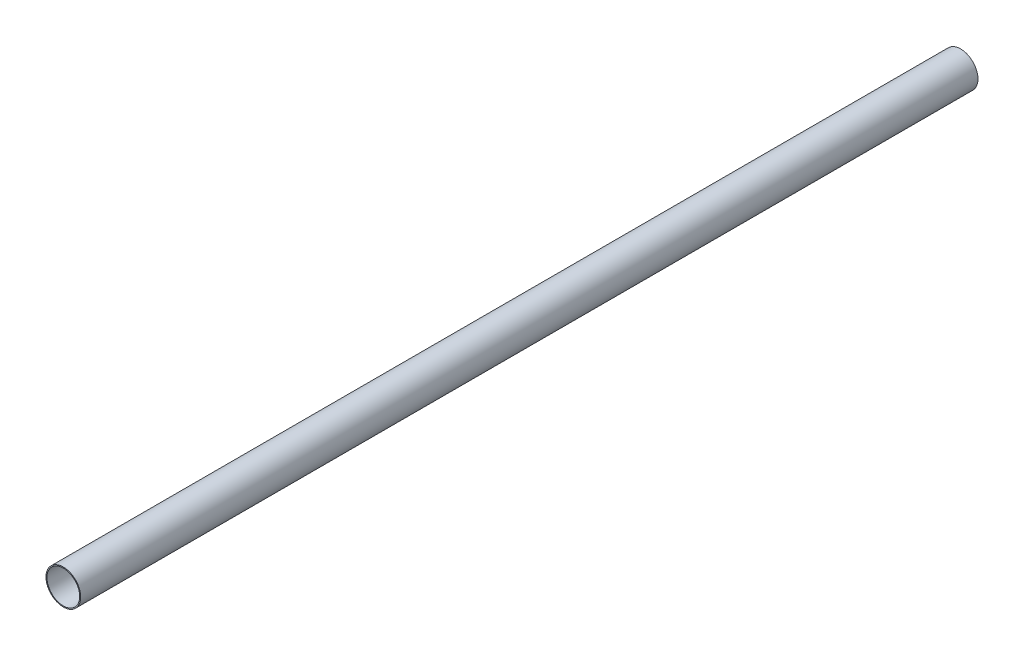
from build123d import *

# Parameters (mm, degrees)
SKETCH1_R           = 22.1107
SKETCH1_R_2         = 20.8407
BOSS_EXTRUDE1_DEPTH = 1143


with BuildPart() as part:
    # Sketch1 → Boss-Extrude1 (new body)
    with BuildSketch(Plane.XY):
        Circle(SKETCH1_R)
        Circle(SKETCH1_R_2, mode=Mode.SUBTRACT)
    extrude(amount=BOSS_EXTRUDE1_DEPTH)


solid = part.part
